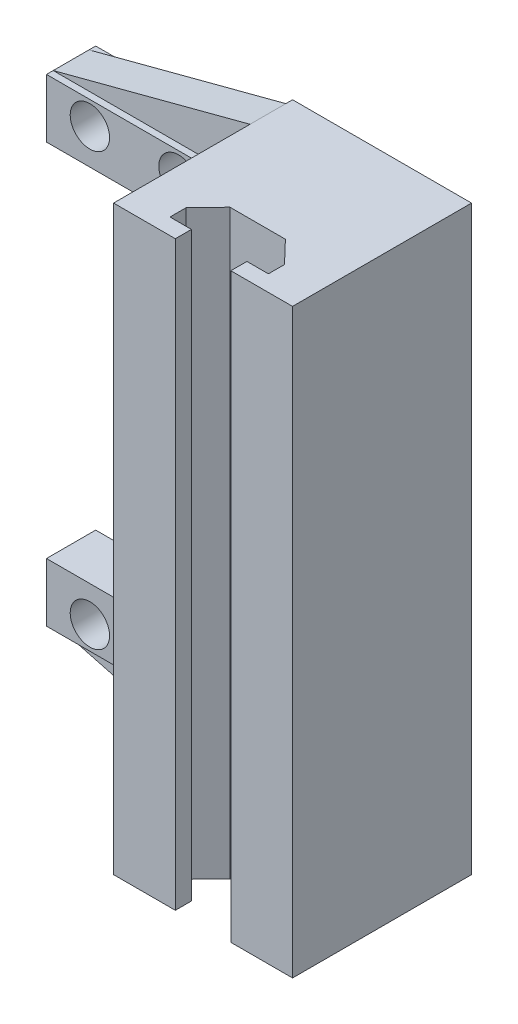
from build123d import *

# Parameters (mm, degrees)
EXTRUDE_1_DEPTH     = 65
SKETCH_2_W          = 5.5
SKETCH_2_H          = 6.55
EXTRUDE_2_DEPTH     = 20
SKETCH_3_R          = 2.2
CUT_EXTRUDE_1_DEPTH = 20
SKETCH_4_W          = 5.5
SKETCH_4_H          = 6.55
EXTRUDE_3_DEPTH     = 2
RIB_7_REACH         = 67.469
SKETCH_5_WALL_W     = 155.689894758
SKETCH_5_WALL_H     = 4
RIB_8_REACH         = 76.607
SKETCH_6_WALL_W     = 173.96567711
SKETCH_6_WALL_H     = 4


with BuildPart() as part:
    # 草图1 → 凸台-拉伸1 (new body)
    with BuildSketch(Plane(origin=(0, 0, 0), x_dir=(1, 0, 0), z_dir=(0, 1, 0))):
        Polygon((-30.289732276, -35.038566896), (-24.089732276, -35.038566896), (-21.689732276, -37.538566896), (-21.689732276, -39.338566896), (-24.089732276, -39.338566896), (-24.089732276, -41.138566896), (-17.189732276, -41.138566896), (-17.189732276, -21.138566896), (-37.189732276, -21.138566896), (-37.189732276, -41.138566896), (-30.289732276, -41.138566896), (-30.289732276, -39.338566896), (-32.689732276, -39.338566896), (-32.689732276, -37.538566896), align=None)
    extrude(amount=EXTRUDE_1_DEPTH)

    # 草图2 → 凸台-拉伸2 (add)
    with BuildSketch(Plane.ZY.offset(37.189732276)):
        with Locations((23.888566896, 9.075)):
            Rectangle(SKETCH_2_W, SKETCH_2_H)
        with Locations((23.888566896, 55.925)):
            Rectangle(SKETCH_2_W, SKETCH_2_H)
    extrude(amount=EXTRUDE_2_DEPTH)

    # 草图3 → 切除-拉伸1 (cut)
    with BuildSketch(Plane(origin=(0, 0, 21.138566896), x_dir=(-1, 0, 0), z_dir=(0, 0, -1))):
        with Locations((54.339732276, 56.6)):
            Circle(SKETCH_3_R)
        with Locations((44.439732276, 56.6)):
            Circle(SKETCH_3_R)
        with Locations((44.439732276, 8.4)):
            Circle(SKETCH_3_R)
        with Locations((54.339732276, 8.4)):
            Circle(SKETCH_3_R)
    extrude(amount=-CUT_EXTRUDE_1_DEPTH, mode=Mode.SUBTRACT)

    # 草图4 → 凸台-拉伸3 (add)
    with BuildSketch(Plane.ZY.offset(57.189732276)):
        with Locations((23.888566896, 55.925)):
            Rectangle(SKETCH_4_W, SKETCH_4_H)
        with Locations((23.888566896, 9.075)):
            Rectangle(SKETCH_4_W, SKETCH_4_H)
    extrude(amount=EXTRUDE_3_DEPTH)

    # 草图5 wall → 筋7 (add, up to next)
    with BuildSketch(Plane(origin=(-48.189732276, 62.1, 23.888566896), x_dir=(0.966960573226, 0.254925969305, 0), z_dir=(0.254925969305, -0.966960573226, 0)), mode=Mode.PRIVATE) as rib_7_sk1:
        Rectangle(SKETCH_5_WALL_W, SKETCH_5_WALL_H)
    rib_7_tool1 = extrude(rib_7_sk1.sketch, amount=RIB_7_REACH, mode=Mode.PRIVATE) - part.part
    add(rib_7_tool1.solids().sort_by_distance((-48.189732276, 62.1, 23.888566896))[0])

    # 草图6 wall → 筋8 (add, up to next)
    with BuildSketch(Plane(origin=(-48.189732276, 2.9, 23.888566896), x_dir=(0.966960573226, -0.254925969305, 0), z_dir=(-0.254925969305, -0.966960573226, 0)), mode=Mode.PRIVATE) as rib_8_sk1:
        Rectangle(SKETCH_6_WALL_W, SKETCH_6_WALL_H)
    rib_8_tool1 = extrude(rib_8_sk1.sketch, amount=-RIB_8_REACH, mode=Mode.PRIVATE) - part.part
    add(rib_8_tool1.solids().sort_by_distance((-48.189732276, 2.9, 23.888566896))[0])


solid = part.part
